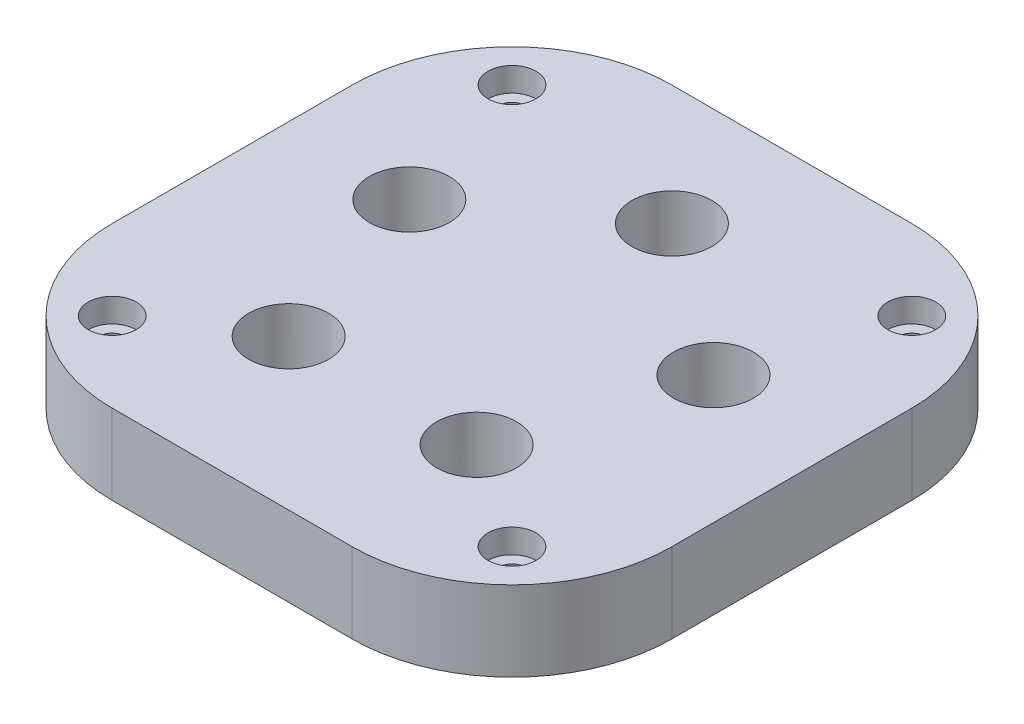
from build123d import *

# Parameters (mm, degrees)
SKETCH_1_R          = 1.6
EXTRUDE_1_DEPTH     = 10
SKETCH_2_R          = 5
CUT_EXTRUDE_1_DEPTH = 25
SKETCH_3_R          = 3
CUT_EXTRUDE_2_DEPTH = 3
CUT_EXTRUDE_START   = -5
SKETCH_4_R          = 5
SKETCH_4_R_2        = 3.5
CUT_EXTRUDE_3_DEPTH = 5


with BuildPart() as part:
    # 草图1 → 凸台-拉伸1 (new body)
    with BuildSketch(Plane(origin=(0, 0, 0), x_dir=(1, 0, 0), z_dir=(0, 1, 0))):
        with BuildLine():
            Line((20, 0), (50, 0))
            ThreePointArc((50, 0), (64.142135624, 5.857864376), (70, 20))
            Line((70, 20), (70, 50))
            ThreePointArc((70, 50), (64.142135624, 64.142135624), (50, 70))
            Line((50, 70), (20, 70))
            ThreePointArc((20, 70), (5.857864376, 64.142135624), (0, 50))
            Line((0, 50), (0, 20))
            ThreePointArc((0, 20), (5.857864376, 5.857864376), (20, 0))
        make_face()
        with Locations(Location((10, 60, 0), (0, 0, 270))):
            Circle(SKETCH_1_R, mode=Mode.SUBTRACT)
        with Locations(Location((60, 60, 0), (0, 0, 270))):
            Circle(SKETCH_1_R, mode=Mode.SUBTRACT)
        with Locations(Location((60, 10, 0), (0, 0, 270))):
            Circle(SKETCH_1_R, mode=Mode.SUBTRACT)
        with Locations(Location((10, 10, 0), (0, 0, 270))):
            Circle(SKETCH_1_R, mode=Mode.SUBTRACT)
    extrude(amount=EXTRUDE_1_DEPTH)

    # 草图2 → 切除-拉伸1 (cut)
    with BuildSketch(Plane(origin=(0, 10, 0), x_dir=(1, 0, 0), z_dir=(0, 1, 0))):
        with Locations(Location((35, 55, 0), (0, 0, 270))):
            Circle(SKETCH_2_R)
        with Locations(Location((54.021130326, 41.180339888, 0), (0, 0, 270))):
            Circle(SKETCH_2_R)
        with Locations(Location((46.755705046, 18.819660113, 0), (0, 0, 270))):
            Circle(SKETCH_2_R)
        with Locations(Location((23.244294954, 18.819660112, 0), (0, 0, 270))):
            Circle(SKETCH_2_R)
        with Locations(Location((15.978869674, 41.180339887, 0), (0, 0, 270))):
            Circle(SKETCH_2_R)
    extrude(amount=-CUT_EXTRUDE_1_DEPTH, mode=Mode.SUBTRACT)

    # 草图3 → 切除-拉伸2 (cut)
    with BuildSketch(Plane(origin=(0, 10, 0), x_dir=(1, 0, 0), z_dir=(0, 1, 0))):
        with Locations(Location((10, 60, 0), (0, 0, 270))):
            Circle(SKETCH_3_R)
        with Locations(Location((60, 60, 0), (0, 0, 270))):
            Circle(SKETCH_3_R)
        with Locations(Location((60, 10, 0), (0, 0, 270))):
            Circle(SKETCH_3_R)
        with Locations(Location((10, 10, 0), (0, 0, 270))):
            Circle(SKETCH_3_R)
    extrude(amount=-CUT_EXTRUDE_2_DEPTH, mode=Mode.SUBTRACT)

    # 草图4 → 切除-拉伸3 (cut)
    with BuildSketch(Plane.XZ.offset(CUT_EXTRUDE_START)):
        with Locations(Location((15.978869674, -41.180339887, 0), (0, 0, 90))):
            Circle(SKETCH_4_R)
        with Locations(Location((35, -55, 0), (0, 0, 90))):
            Circle(SKETCH_4_R)
        with Locations(Location((54.021130326, -41.180339888, 0), (0, 0, 90))):
            Circle(SKETCH_4_R)
        with Locations(Location((46.755705046, -18.819660113, 0), (0, 0, 90))):
            Circle(SKETCH_4_R)
        with Locations(Location((23.244294954, -18.819660112, 0), (0, 0, 90))):
            Circle(SKETCH_4_R)
        with Locations(Location((35, -35, 0), (0, 0, 270))):
            Circle(SKETCH_4_R_2)
    extrude(amount=CUT_EXTRUDE_3_DEPTH, mode=Mode.SUBTRACT)


solid = part.part
